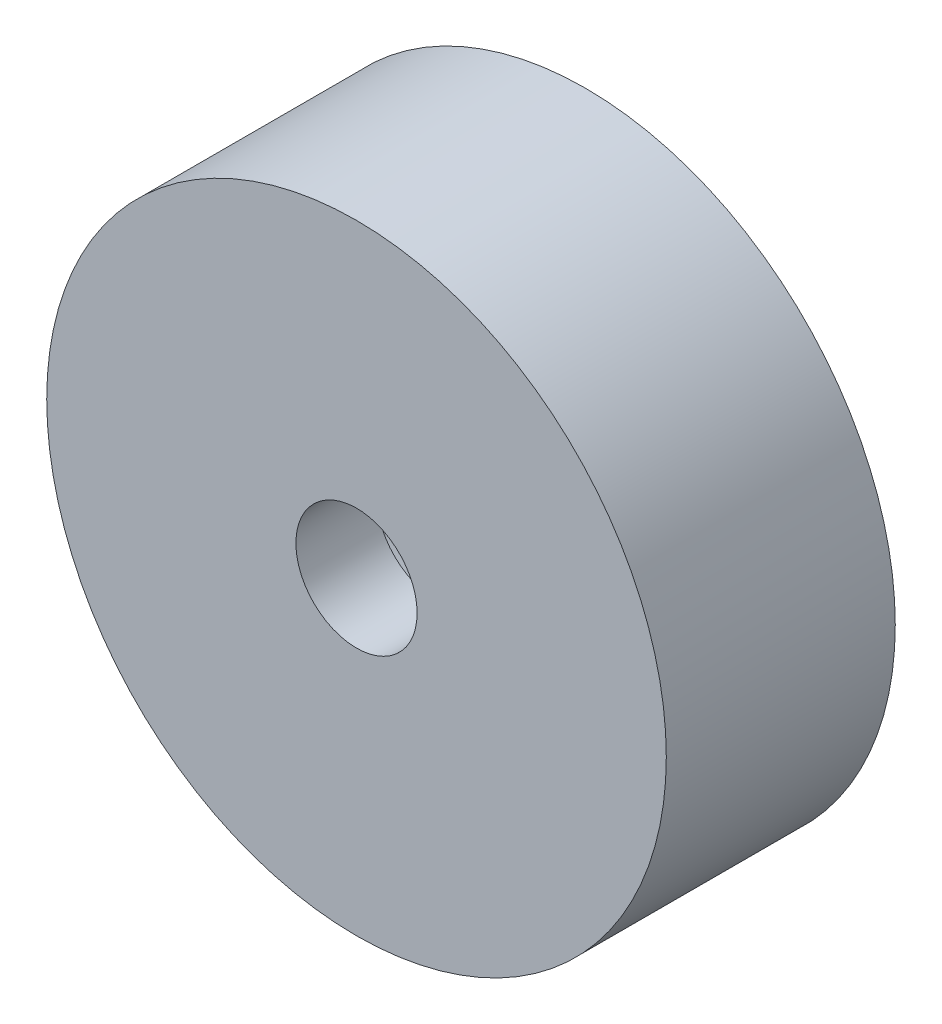
from build123d import *

# Parameters (mm, degrees)
SKETCH1_R           = 11.5
SKETCH1_R_2         = 9.5
BOSS_EXTRUDE1_DEPTH = 3.5
SKETCH2_R           = 11.5
SKETCH2_R_2         = 2.25
BOSS_EXTRUDE2_DEPTH = 1.5


with BuildPart() as part:
    # Sketch1 → Boss-Extrude1 (new, symmetric)
    with BuildSketch(Plane.XY):
        Circle(SKETCH1_R)
        Circle(SKETCH1_R_2, mode=Mode.SUBTRACT)
    extrude(amount=BOSS_EXTRUDE1_DEPTH, both=True)

    # Sketch2 → Boss-Extrude2 (add, symmetric)
    with BuildSketch(Plane.XY.offset(3.5)):
        Circle(SKETCH2_R)
        Circle(SKETCH2_R_2, mode=Mode.SUBTRACT)
    extrude(amount=BOSS_EXTRUDE2_DEPTH, both=True)


solid = part.part
